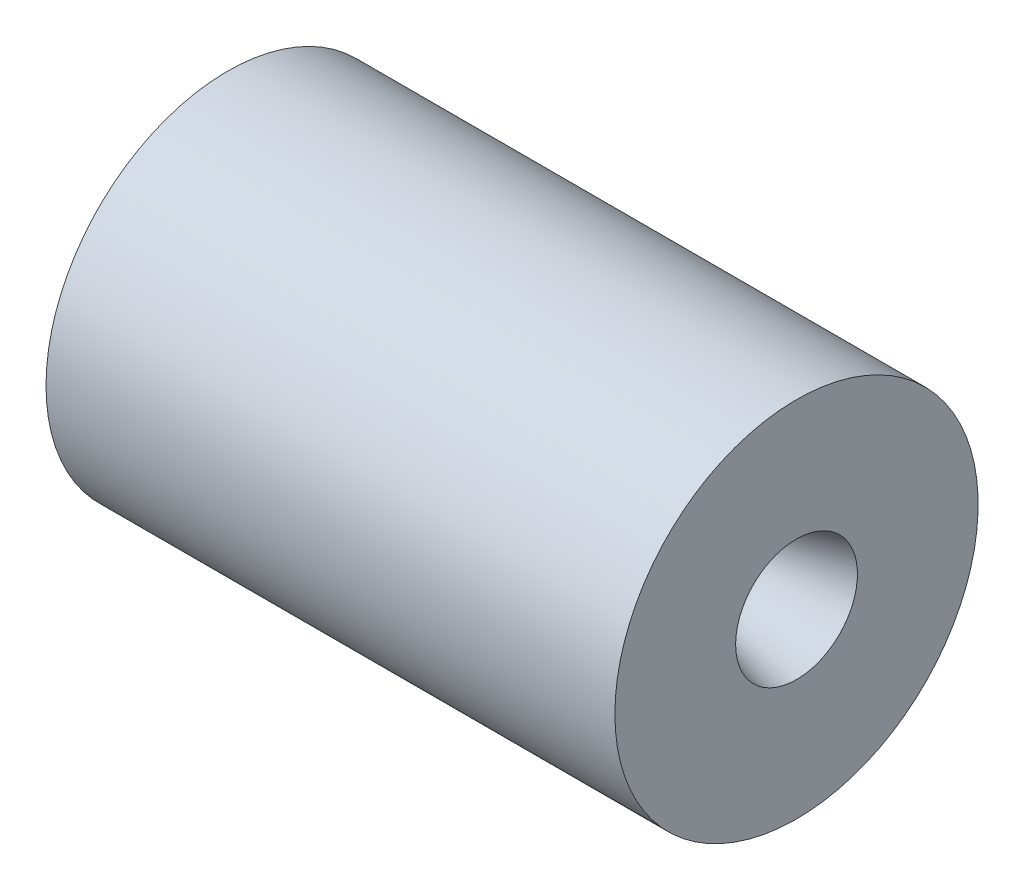
from build123d import *


with BuildPart() as part:
    # Sketch1 → Revolve1 (revolve)
    with BuildSketch(Plane.XY, mode=Mode.PRIVATE) as revolve1_sk:
        with BuildLine():
            Line((-57.482999588, 19.05), (-18.926427283, 19.05))
            ThreePointArc((-18.926427283, 19.05), (-14.731391707, 18.069235016), (-11.406001811, 15.330256106))
            Line((-11.406001811, 15.330256106), (-3.676186486, 5.207))
            ThreePointArc((-3.676186486, 5.207), (-2.051025346, 3.857735121), (0, 3.3528))
            ThreePointArc((0, 3.3528), (0.414402348, 3.375072305), (0.821750452, 3.4544))
            Line((0.821750452, 3.4544), (18.172025124, 8.100703128))
            Line((18.172025124, 8.100703128), (18.172025124, 24.1554))
            Line((18.172025124, 24.1554), (-57.482999588, 24.1554))
            Line((-57.482999588, 24.1554), (-57.482999588, 19.05))
        make_face()
    revolve(revolve1_sk.sketch.rotate(Axis((-50.899256216, 0, 0), (1, 0, 0)), 90), axis=Axis((-50.899256216, 0, 0), (1, 0, 0)))


solid = part.part
